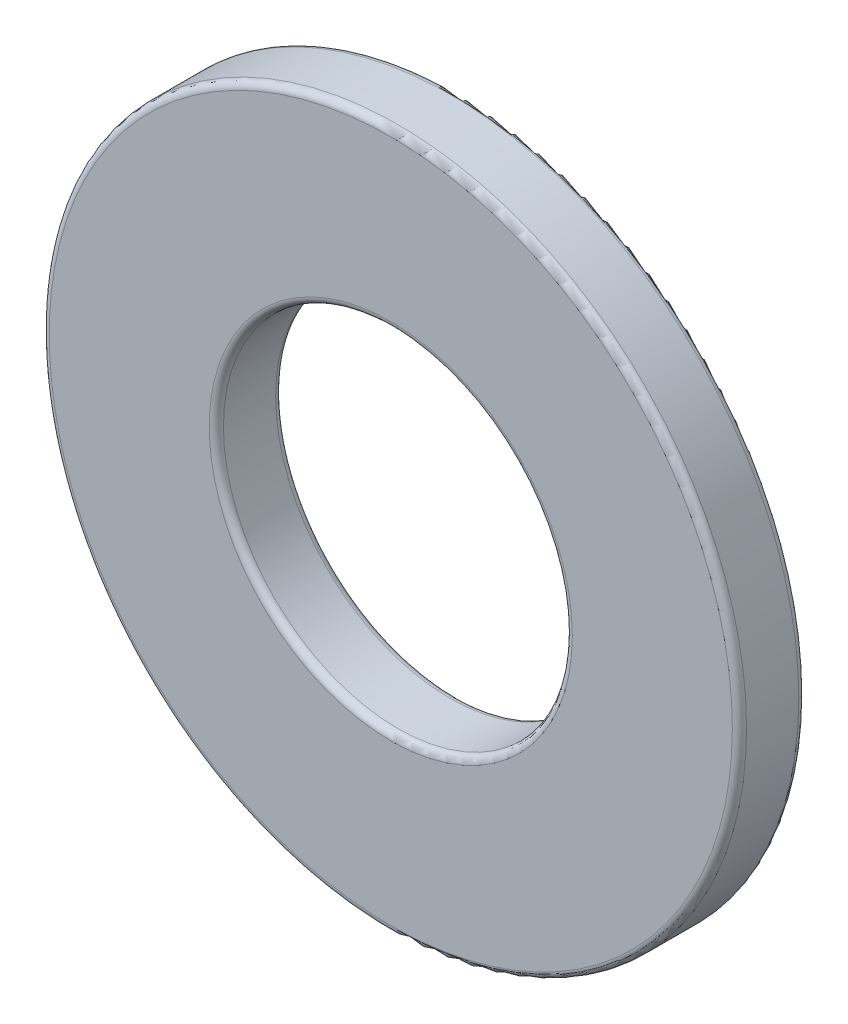
from build123d import *

# Parameters (mm, degrees)
SKETCH1_R           = 8.73125
SKETCH1_R_2         = 4.3688
BOSS_EXTRUDE1_DEPTH = 0.83185
FILLET2_R           = 0.1778


with BuildPart() as part:
    # Sketch1 → Boss-Extrude1 (new, symmetric)
    with BuildSketch(Plane(origin=(0, 0, 0), x_dir=(0, 1, 0), z_dir=(0, 0, 1))):
        with Locations(Location((0, 0, 0), (0, 0, 270))):
            Circle(SKETCH1_R)
        with Locations(Location((0, 0, 0), (0, 0, 270))):
            Circle(SKETCH1_R_2, mode=Mode.SUBTRACT)
    extrude(amount=BOSS_EXTRUDE1_DEPTH, both=True)

    # Fillet2
    fillet2_edges = [part.edges().sort_by_distance(p)[0] for p in [
        (-8.73125, 0, -0.83185),
        (-8.73125, 0, 0.83185),
        (-4.3688, 0, -0.83185),
        (-4.3688, 0, 0.83185),
    ]]
    fillet(fillet2_edges, radius=FILLET2_R)


solid = part.part
